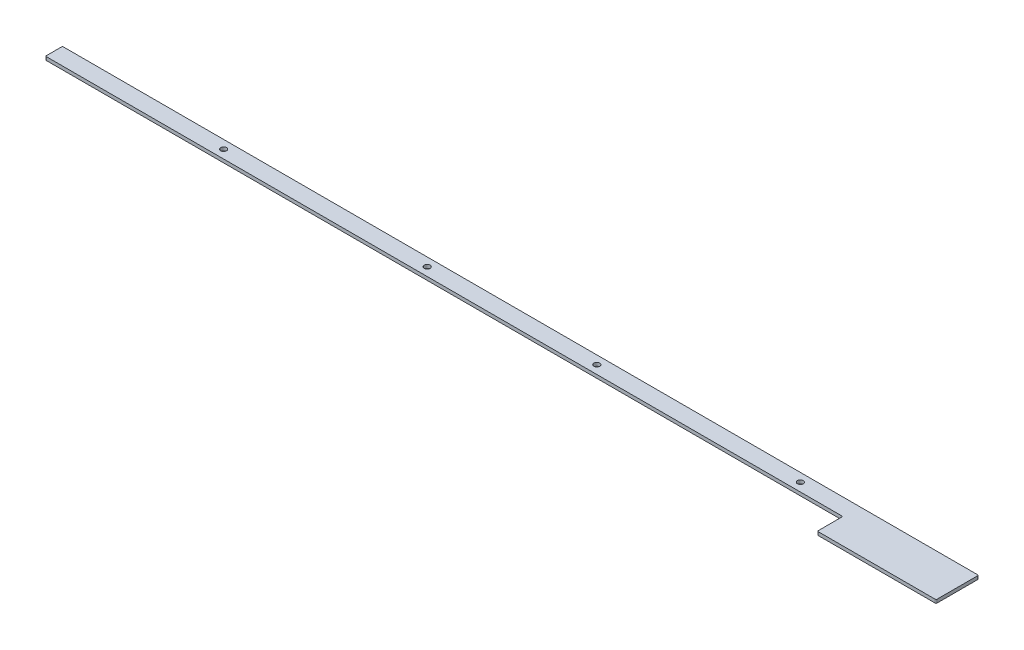
from build123d import *

# Parameters (mm, degrees)
SKETCH1_W                = 540
SKETCH1_H                = 10
BOSS_EXTRUDE1_DEPTH      = 2
SKETCH2_W                = 70
SKETCH2_H                = 15
BOSS_EXTRUDE2_DEPTH      = 2
M3_CLEARANCE_HOLE1_D     = 3.4
M3_CLEARANCE_HOLE1_DEPTH = 10
M3_CLEARANCE_HOLE1_TIP   = 1.021463052
FILLET1_R                = 0.5


with BuildPart() as part:
    # Sketch1 → Boss-Extrude1 (new body)
    with BuildSketch(Plane(origin=(0, 0, 0), x_dir=(1, 0, 0), z_dir=(0, 1, 0))):
        Rectangle(SKETCH1_W, SKETCH1_H)
    extrude(amount=BOSS_EXTRUDE1_DEPTH)

    # Sketch2 → Boss-Extrude2 (add)
    with BuildSketch(Plane(origin=(0, 2, 0), x_dir=(1, 0, 0), z_dir=(0, 1, 0))):
        with Locations((235, -12.5)):
            Rectangle(SKETCH2_W, SKETCH2_H)
    extrude(amount=-BOSS_EXTRUDE2_DEPTH)

    # M3 Clearance Hole1
    with Locations(Plane(origin=(-170, 2, 0), x_dir=(0, 0, 1), z_dir=(0, 1, 0))):
        with Locations((0, 0), (0, 120), (0, 220), (0, 340)):
            Hole(M3_CLEARANCE_HOLE1_D / 2, depth=M3_CLEARANCE_HOLE1_DEPTH)
            with Locations((0, 0, -(M3_CLEARANCE_HOLE1_DEPTH + M3_CLEARANCE_HOLE1_TIP / 2))):  # 118° drill point
                Cone(0, M3_CLEARANCE_HOLE1_D / 2, M3_CLEARANCE_HOLE1_TIP, mode=Mode.SUBTRACT)

    # Fillet1
    fillet1_edges = [part.edges().sort_by_distance(p)[0] for p in [
        (270, 1, 20),
        (200, 1, 20),
        (200, 1, 5),
        (-270, 1, -5),
        (270, 1, -5),
        (-270, 1, 5),
    ]]
    fillet(fillet1_edges, radius=FILLET1_R)


solid = part.part
